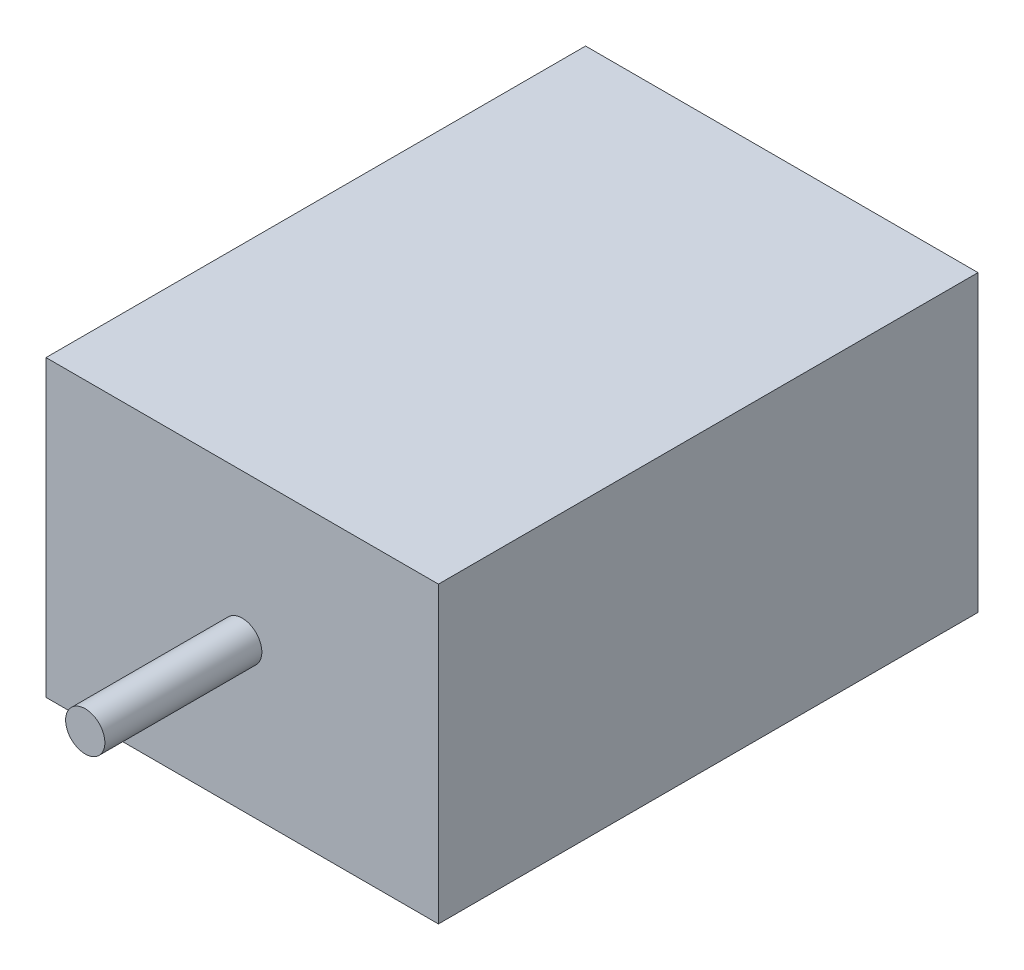
from build123d import *

# Parameters (mm, degrees)
SKETCH1_W                 = 20
SKETCH1_H                 = 15
MOTOR_BODY_ENVELOPE_DEPTH = 27.5
REFERENCE_2MM_SHAFT_START = 27.5
SKETCH2_R                 = 1
REFERENCE_2MM_SHAFT_DEPTH = 8


with BuildPart() as part:
    # Sketch1 → Motor_Body_Envelope (new body)
    with BuildSketch(Plane.XY):
        Rectangle(SKETCH1_W, SKETCH1_H)
    extrude(amount=MOTOR_BODY_ENVELOPE_DEPTH)

    # Sketch2 → Reference_2mm_Shaft (add)
    with BuildSketch(Plane.XY.offset(REFERENCE_2MM_SHAFT_START)):
        with Locations(Location((0, 0, 0), (0, 0, 180))):
            Circle(SKETCH2_R)
    extrude(amount=REFERENCE_2MM_SHAFT_DEPTH)


solid = part.part
